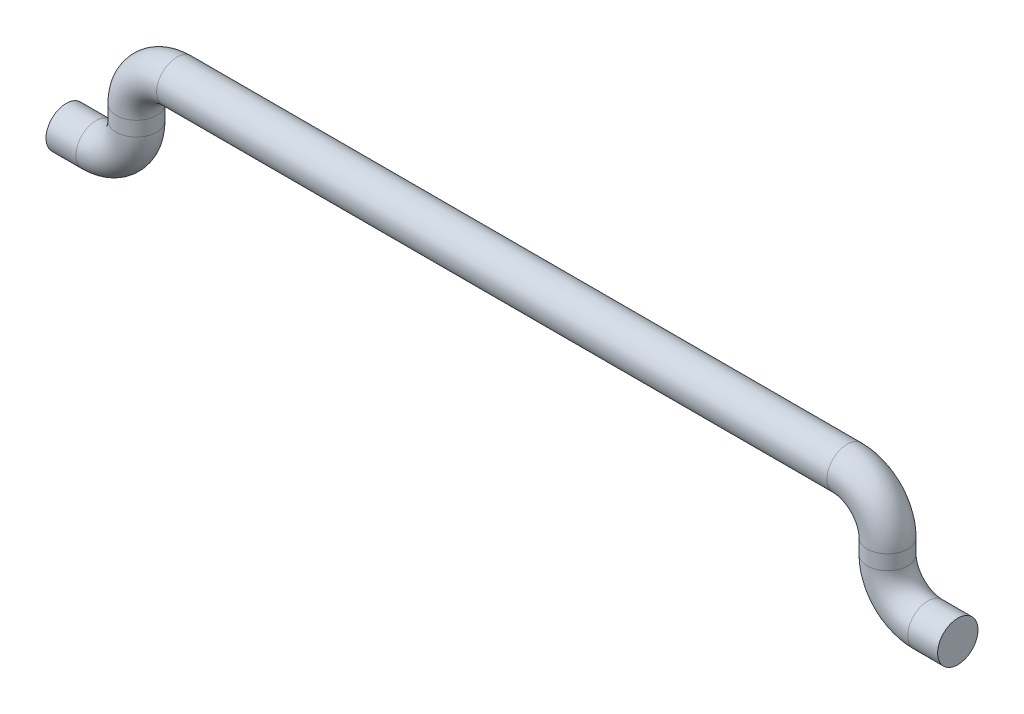
from build123d import *

# Parameters (mm, degrees)
CROQUIS2_R = 1.25


with BuildPart() as part:
    # Barrer1: sweep along a path in Croquis1
    with BuildLine(Plane.XY) as barrer1_path:
        Line((-27.6, -5.9), (-25.75, -5.9))
        ThreePointArc((-25.75, -5.9), (-23.982233047, -5.167766953), (-23.25, -3.4))
        Line((-23.25, -3.4), (-23.25, -2.5))
        ThreePointArc((-23.25, -2.5), (-22.517766953, -0.732233047), (-20.75, 0))
        Line((-20.75, 0), (20.75, 0))
        ThreePointArc((20.75, 0), (22.517766953, -0.732233047), (23.25, -2.5))
        Line((23.25, -2.5), (23.25, -3.4))
        ThreePointArc((23.25, -3.4), (23.982233047, -5.167766953), (25.75, -5.9))
        Line((25.75, -5.9), (27.6, -5.9))
    # Croquis2 → Barrer1 (sweep)
    with BuildSketch(Plane(origin=(27.6, 0, 0), x_dir=(0, 0, -1), z_dir=(1, 0, 0))):
        with Locations((0, -5.9)):
            Circle(CROQUIS2_R)
    sweep(path=barrer1_path.line)


solid = part.part
